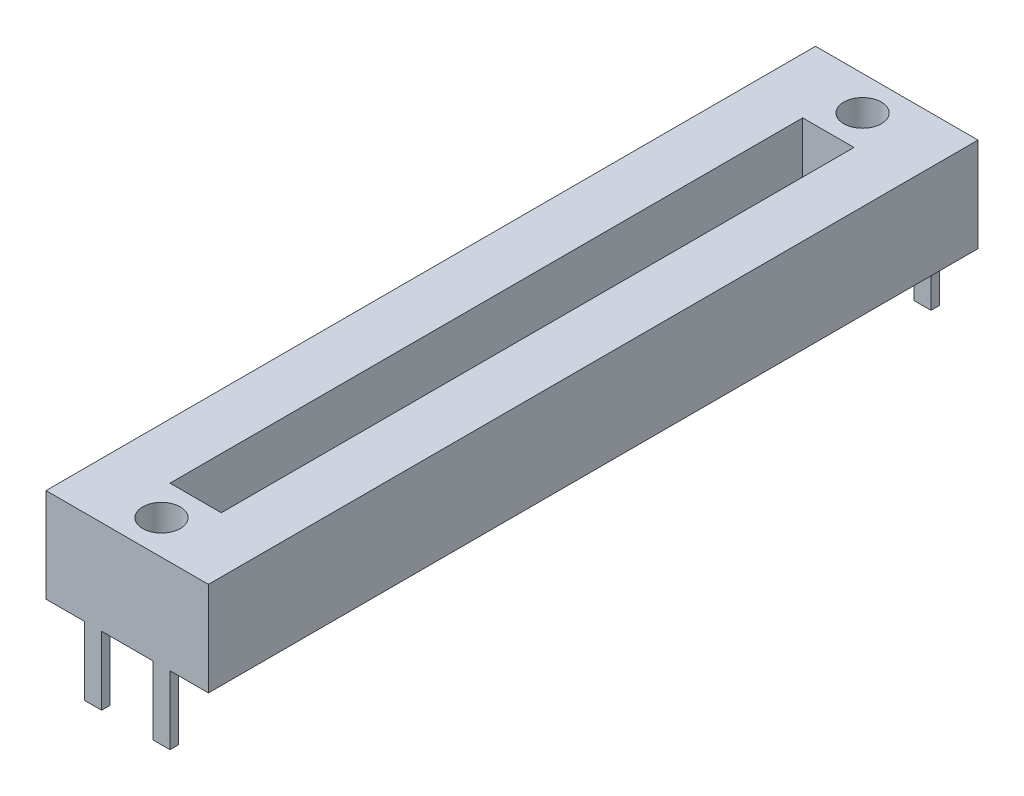
from build123d import *

# Parameters (mm, degrees)
SKETCH_1_W          = 9.5
SKETCH_1_H          = 45
EXTRUDE_1_DEPTH     = 5.5
SKETCH_2_W          = 3
SKETCH_2_H          = 37
CUT_EXTRUDE_1_DEPTH = 3
SKETCH_3_R          = 1.1
CUT_EXTRUDE_2_DEPTH = 3
SKETCH_4_W          = 1
SKETCH_4_H          = 0.5
EXTRUDE_2_DEPTH     = 4


with BuildPart() as part:
    # 草图1 → 凸台-拉伸1 (new body)
    with BuildSketch(Plane(origin=(0, 0, 0), x_dir=(1, 0, 0), z_dir=(0, 1, 0))):
        Rectangle(SKETCH_1_W, SKETCH_1_H)
    extrude(amount=EXTRUDE_1_DEPTH)

    # 草图2 → 切除-拉伸1 (cut)
    with BuildSketch(Plane(origin=(0, 5.5, 0), x_dir=(1, 0, 0), z_dir=(0, 1, 0))):
        Rectangle(SKETCH_2_W, SKETCH_2_H)
    extrude(amount=-CUT_EXTRUDE_1_DEPTH, mode=Mode.SUBTRACT)

    # 草图3 → 切除-拉伸2 (cut)
    with BuildSketch(Plane(origin=(0, 5.5, 0), x_dir=(1, 0, 0), z_dir=(0, 1, 0))):
        with Locations(Location((0, -20.5, 0), (0, 0, 270))):
            Circle(SKETCH_3_R)
        with Locations(Location((0, 20.5, 0), (0, 0, 90))):
            Circle(SKETCH_3_R)
    extrude(amount=-CUT_EXTRUDE_2_DEPTH, mode=Mode.SUBTRACT)

    # 草图4 → 凸台-拉伸2 (add)
    with BuildSketch(Plane.XZ):
        with Locations((2, 22.25)):
            Rectangle(SKETCH_4_W, SKETCH_4_H)
        with Locations((-2, 22.25)):
            Rectangle(SKETCH_4_W, SKETCH_4_H)
        with Locations((2, -22.25)):
            Rectangle(SKETCH_4_W, SKETCH_4_H)
    extrude(amount=EXTRUDE_2_DEPTH)


solid = part.part
